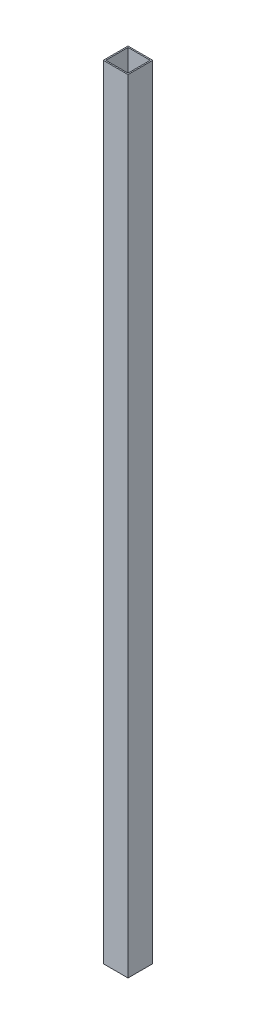
from build123d import *

# Parameters (mm, degrees)
SKETCH1_W           = 25.4
SKETCH1_H           = 25.4
BOSS_EXTRUDE1_DEPTH = 803.275
SKETCH3_W           = 22.86
SKETCH3_H           = 22.86
CUT_EXTRUDE1_DEPTH  = 805.077760932


with BuildPart() as part:
    # Sketch1 → Boss-Extrude1 (new body)
    with BuildSketch(Plane(origin=(0, 0, 0), x_dir=(1, 0, 0), z_dir=(0, 1, 0))):
        with Locations((12.7, 12.7)):
            Rectangle(SKETCH1_W, SKETCH1_H)
    extrude(amount=BOSS_EXTRUDE1_DEPTH)

    # Sketch3 → Cut-Extrude1 (cut, through all)
    with BuildSketch(Plane(origin=(0, 803.275, 0), x_dir=(1, 0, 0), z_dir=(0, 1, 0))):
        with Locations((12.7, 12.7)):
            Rectangle(SKETCH3_W, SKETCH3_H)
    extrude(amount=-CUT_EXTRUDE1_DEPTH, mode=Mode.SUBTRACT)


solid = part.part
